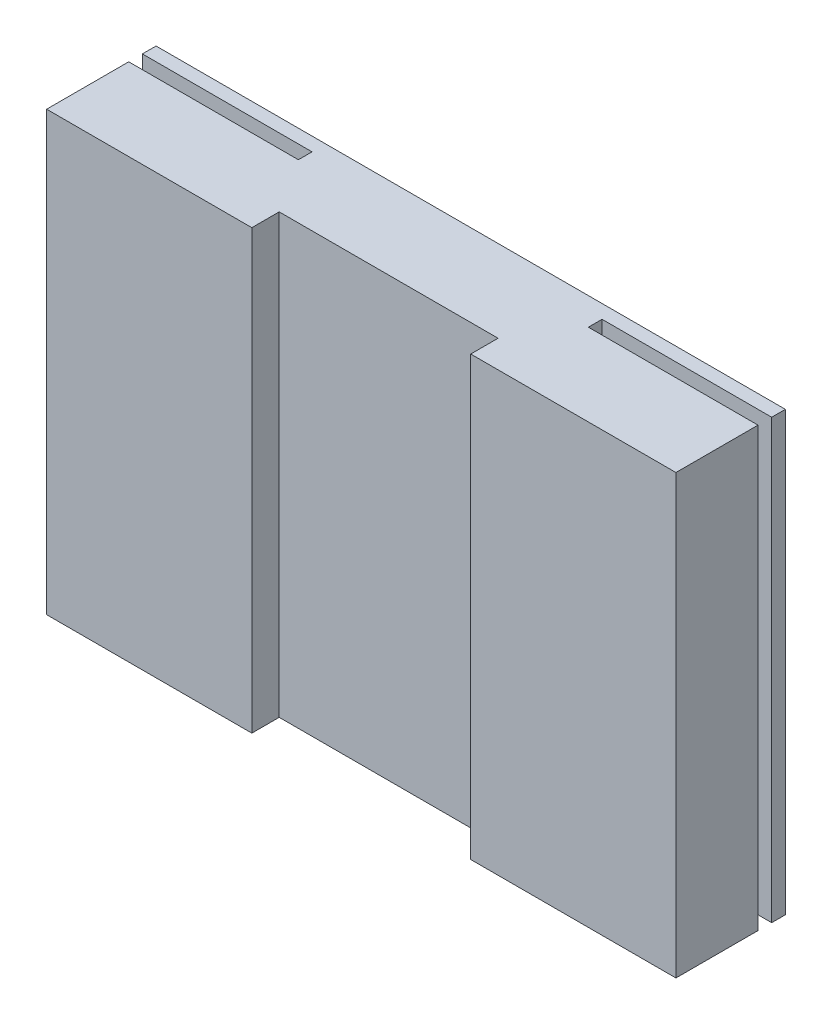
from build123d import *

# Parameters (mm, degrees)
SKETCH1_W           = 36.5125
SKETCH1_H           = 4.7625
BOSS_EXTRUDE1_DEPTH = 25.4
SKETCH2_W           = 12.7
SKETCH2_H           = 1.5875
CUT_EXTRUDE1_DEPTH  = 25.4
SKETCH3_W           = 16.8275
SKETCH3_H           = 25.4
BOSS_EXTRUDE2_DEPTH = 0.79375
SKETCH4_W           = 36.5125
SKETCH4_H           = 25.4
BOSS_EXTRUDE3_DEPTH = 0.79375


with BuildPart() as part:
    # Sketch1 → Boss-Extrude1 (new body)
    with BuildSketch(Plane(origin=(0, 0, 0), x_dir=(1, 0, 0), z_dir=(0, 1, 0))):
        Rectangle(SKETCH1_W, SKETCH1_H)
    extrude(amount=BOSS_EXTRUDE1_DEPTH)

    # Sketch2 → Cut-Extrude1 (cut)
    with BuildSketch(Plane(origin=(0, 25.4, 0), x_dir=(1, 0, 0), z_dir=(0, 1, 0))):
        with Locations((0, -1.5875)):
            Rectangle(SKETCH2_W, SKETCH2_H)
    extrude(amount=-CUT_EXTRUDE1_DEPTH, mode=Mode.SUBTRACT)

    # Sketch3 → Boss-Extrude2 (add)
    with BuildSketch(Plane(origin=(0, 0, -2.38125), x_dir=(-1, 0, 0), z_dir=(0, 0, -1))):
        with Locations((0, 12.7)):
            Rectangle(SKETCH3_W, SKETCH3_H)
    extrude(amount=BOSS_EXTRUDE2_DEPTH)

    # Sketch4 → Boss-Extrude3 (add)
    with BuildSketch(Plane(origin=(0, 0, -3.175), x_dir=(-1, 0, 0), z_dir=(0, 0, -1))):
        with Locations((0, 12.7)):
            Rectangle(SKETCH4_W, SKETCH4_H)
    extrude(amount=BOSS_EXTRUDE3_DEPTH)


solid = part.part
